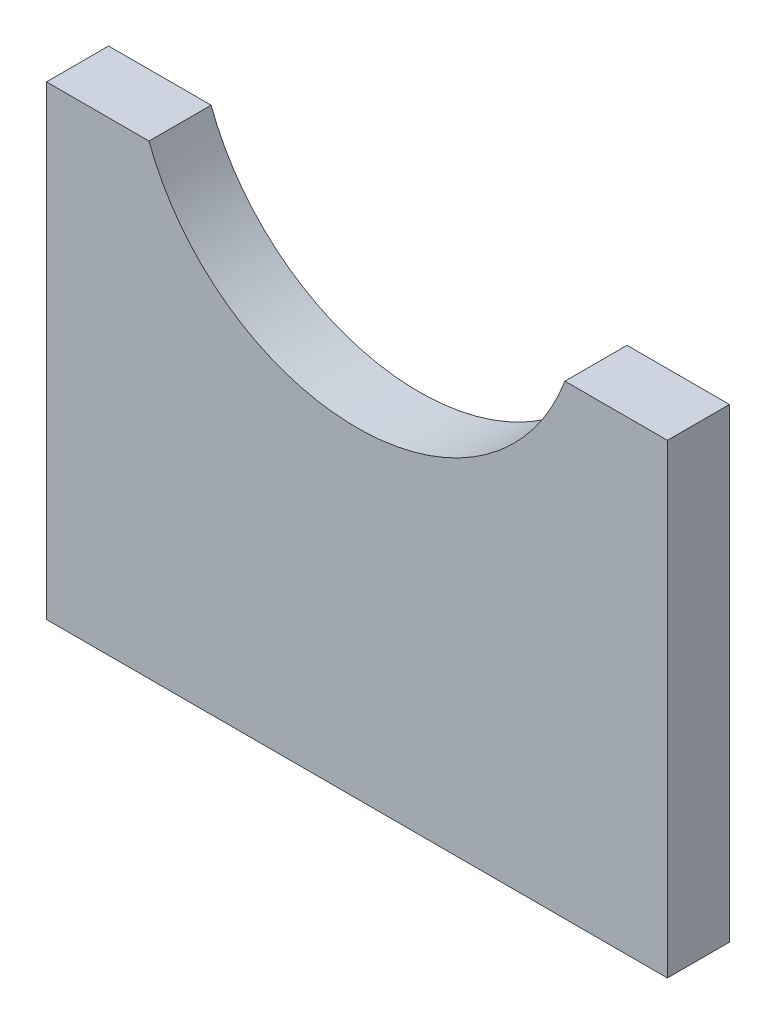
from build123d import *

# Parameters (mm, degrees)
SKETCH1_W           = 40
SKETCH1_H           = 30
BOSS_EXTRUDE1_DEPTH = 4
CUT_EXTRUDE3_REACH  = 39.417
SKETCH5_R           = 14.3


with BuildPart() as part:
    # Sketch1 → Boss-Extrude1 (new body)
    with BuildSketch(Plane.XY.offset(-47.75)):
        with Locations((-2, 15)):
            Rectangle(SKETCH1_W, SKETCH1_H)
    extrude(amount=BOSS_EXTRUDE1_DEPTH)

    # Sketch5 → Cut-Extrude3 (cut, up to next)
    with BuildSketch(Plane.XY.offset(-43.75), mode=Mode.PRIVATE) as cut_extrude3_sk1:
        with Locations((-2, 35)):
            Circle(SKETCH5_R)
    cut_extrude3_tool1 = extrude(cut_extrude3_sk1.sketch, amount=-CUT_EXTRUDE3_REACH, mode=Mode.PRIVATE) & part.part
    add(cut_extrude3_tool1.solids().sort_by_distance((-2, 35, -43.75))[0], mode=Mode.SUBTRACT)


solid = part.part
